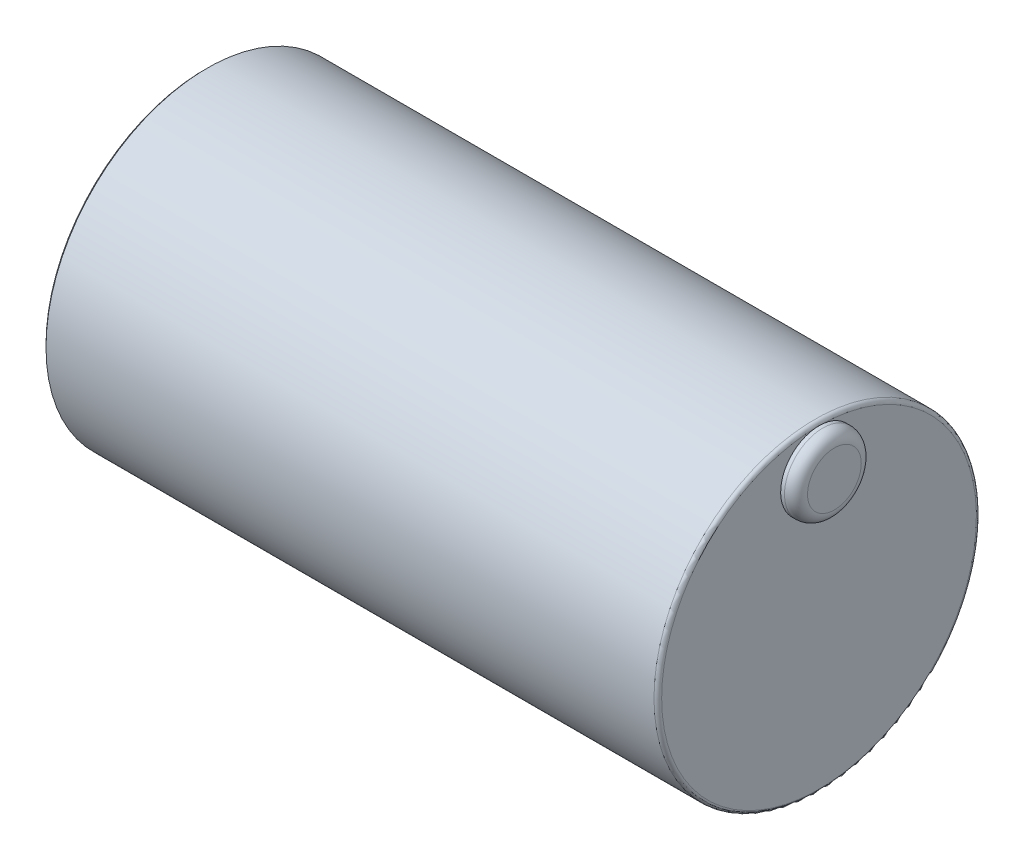
from build123d import *

# Parameters (mm, degrees)
CHANFREIN1_SIZE              = 0.3
CONG_1_R                     = 0.5
ESQUISSE2_R                  = 5
BOSS_EXTRU_1_DEPTH           = 2
CONG_2_R                     = 1.5
R_P_TITION_CIRCULAIRE1_COUNT = 4


with BuildPart() as part:
    # Esquisse1 → Révolution1 (revolve)
    with BuildSketch(Plane.XY):
        Polygon((0, 0), (0, 11), (2, 11), (2, 21), (82, 21), (82, 0), align=None)
    revolve(axis=Axis((-33.755102041, 0, 0), (1, 0, 0)))

    # Chanfrein1
    chanfrein1_edges = [part.edges().sort_by_distance(p)[0] for p in [
        (0, -11, 0),
        (2, -21, 0),
    ]]
    chamfer(chanfrein1_edges, length=CHANFREIN1_SIZE)

    # Congé1
    cong_1_edges = [part.edges().sort_by_distance(p)[0] for p in [
        (82, -21, 0),
    ]]
    fillet(cong_1_edges, radius=CONG_1_R)

    # Esquisse2 → Boss.-Extru.1 (add)
    with BuildSketch(Plane(origin=(82, 0, 0), x_dir=(0, 0, -1), z_dir=(1, 0, 0))):
        with Locations((0, 15.5)):
            Circle(ESQUISSE2_R)
    extrude(amount=BOSS_EXTRU_1_DEPTH)

    # Congé2
    cong_2_edges = [part.edges().sort_by_distance(p)[0] for p in [
        (84, 15.5, 5),
    ]]
    fillet(cong_2_edges, radius=CONG_2_R)

    # Esquisse4 → Trou pour taraudage pour trou taraudé M41 (revolve, cut)
    with BuildSketch(Plane(origin=(2, 16, 0), x_dir=(0, 0, 1), z_dir=(0, 1, 0))):
        Polygon((0, 0), (0, 8.991420021), (1.65, 8), (1.65, 0), align=None)
    trou_pour_taraudage_pour_trou_taraud_m4 = revolve(axis=Axis((-4.35, 16, 0), (1, 0, 0)), mode=Mode.SUBTRACT)

    # Répétition circulaire1: Trou pour taraudage pour trou taraudé M41 ×4 about axis
    r_p_tition_circulaire1_axis = Axis((2, 0, 0), (-1, 0, 0))
    for i in range(1, R_P_TITION_CIRCULAIRE1_COUNT):
        add(trou_pour_taraudage_pour_trou_taraud_m4.rotate(r_p_tition_circulaire1_axis, i * 360 / R_P_TITION_CIRCULAIRE1_COUNT), mode=Mode.SUBTRACT)


solid = part.part
